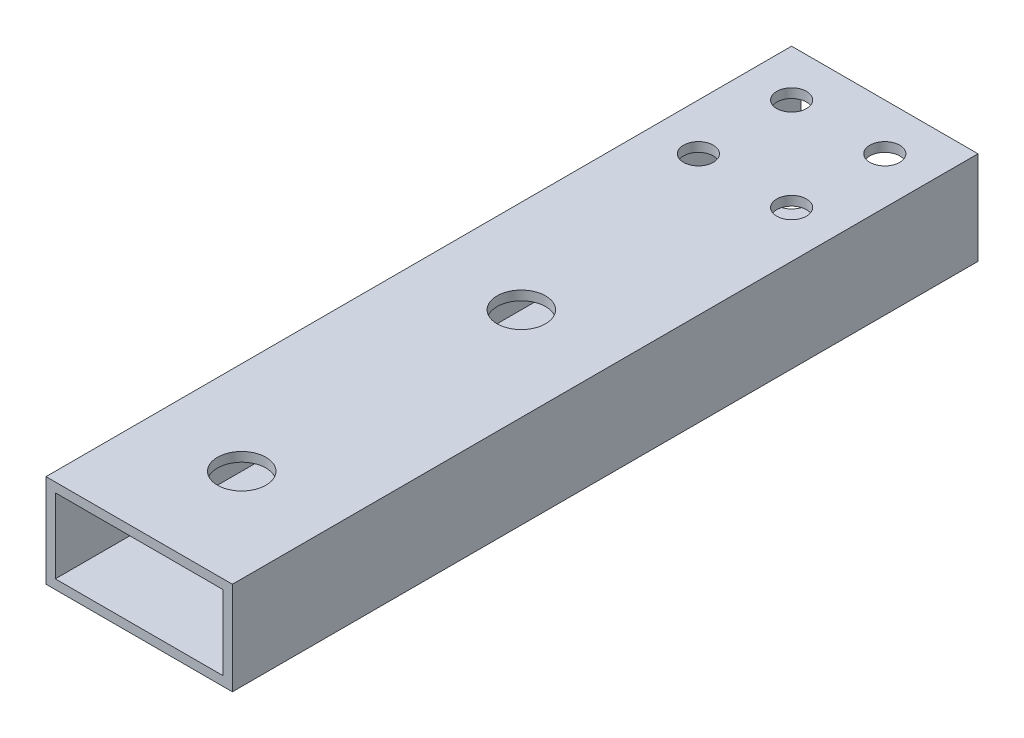
from build123d import *

# Parameters (mm, degrees)
SKETCH_1_W          = 20
SKETCH_1_H          = 10
SKETCH_1_W_2        = 18
SKETCH_1_H_2        = 8
EXTRUDE_1_DEPTH     = 80
SKETCH_3_R          = 1.6
SKETCH_3_R_2        = 2.6
CUT_EXTRUDE_1_DEPTH = 84.066238629


with BuildPart() as part:
    # 草图1 → 拉伸-薄壁1 (new body)
    with BuildSketch(Plane.XY):
        with Locations((10, -5)):
            Rectangle(SKETCH_1_W, SKETCH_1_H)
        with Locations((10, -5)):
            Rectangle(SKETCH_1_W_2, SKETCH_1_H_2, mode=Mode.SUBTRACT)
    extrude(amount=EXTRUDE_1_DEPTH)

    # 草图3 → 切除-拉伸1 (cut, through all)
    with BuildSketch(Plane(origin=(0, 0, 0), x_dir=(1, 0, 0), z_dir=(0, 1, 0))):
        with Locations(Location((5, -5, 0), (0, 0, 270))):
            Circle(SKETCH_3_R)
        with Locations(Location((15, -5, 0), (0, 0, 90))):
            Circle(SKETCH_3_R)
        with Locations(Location((15, -15, 0), (0, 0, 270))):
            Circle(SKETCH_3_R)
        with Locations(Location((5, -15, 0), (0, 0, 90))):
            Circle(SKETCH_3_R)
        with Locations(Location((10, -69, 0), (0, 0, 270))):
            Circle(SKETCH_3_R_2)
        with Locations(Location((10, -39, 0), (0, 0, 270))):
            Circle(SKETCH_3_R_2)
    extrude(amount=-CUT_EXTRUDE_1_DEPTH, mode=Mode.SUBTRACT)


solid = part.part
